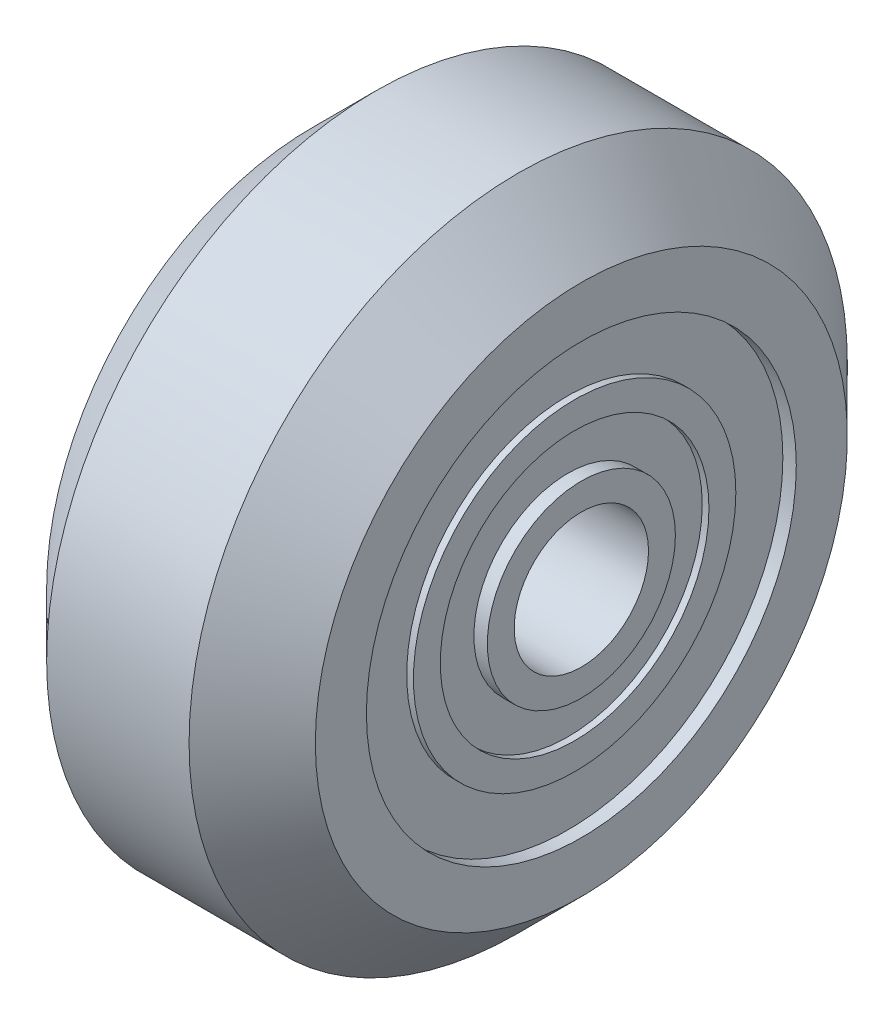
from build123d import *

# Parameters (mm, degrees)
SKETCH3_R           = 8
SKETCH3_R_2         = 6
BOSS_EXTRUDE1_DEPTH = 4.5
SKETCH3_4_R         = 6
SKETCH3_4_R_2       = 5
BOSS_EXTRUDE3_DEPTH = 4.75
SKETCH3_5_R         = 5
SKETCH3_5_R_2       = 3.5
BOSS_EXTRUDE4_DEPTH = 4.5
SKETCH3_6_R         = 3.5
SKETCH3_6_R_2       = 2.5
BOSS_EXTRUDE5_DEPTH = 5


with BuildPart() as part:
    # Sketch2 → Revolve1 (revolve)
    with BuildSketch(Plane.XY):
        Polygon((-5, 8), (-5, 9.9), (-2.65, 12.25), (2.65, 12.25), (5, 9.9), (5, 8), align=None)
    revolve(axis=Axis((-45.586046512, 0, 0), (1, 0, 0)))

    # Sketch3 → Boss-Extrude1 (add, symmetric)
    with BuildSketch(Plane(origin=(0, 0, 0), x_dir=(0, 0, -1), z_dir=(1, 0, 0))):
        Circle(SKETCH3_R)
        Circle(SKETCH3_R_2, mode=Mode.SUBTRACT)
    extrude(amount=BOSS_EXTRUDE1_DEPTH, both=True)

    # Sketch3<4> → Boss-Extrude3 (add, symmetric)
    with BuildSketch(Plane(origin=(0, 0, 0), x_dir=(0, 0, -1), z_dir=(1, 0, 0))):
        Circle(SKETCH3_4_R)
        Circle(SKETCH3_4_R_2, mode=Mode.SUBTRACT)
    extrude(amount=BOSS_EXTRUDE3_DEPTH, both=True)

    # Sketch3<5> → Boss-Extrude4 (add, symmetric)
    with BuildSketch(Plane(origin=(0, 0, 0), x_dir=(0, 0, -1), z_dir=(1, 0, 0))):
        Circle(SKETCH3_5_R)
        Circle(SKETCH3_5_R_2, mode=Mode.SUBTRACT)
    extrude(amount=BOSS_EXTRUDE4_DEPTH, both=True)

    # Sketch3<6> → Boss-Extrude5 (add, symmetric)
    with BuildSketch(Plane(origin=(0, 0, 0), x_dir=(0, 0, -1), z_dir=(1, 0, 0))):
        Circle(SKETCH3_6_R)
        Circle(SKETCH3_6_R_2, mode=Mode.SUBTRACT)
    extrude(amount=BOSS_EXTRUDE5_DEPTH, both=True)


solid = part.part
